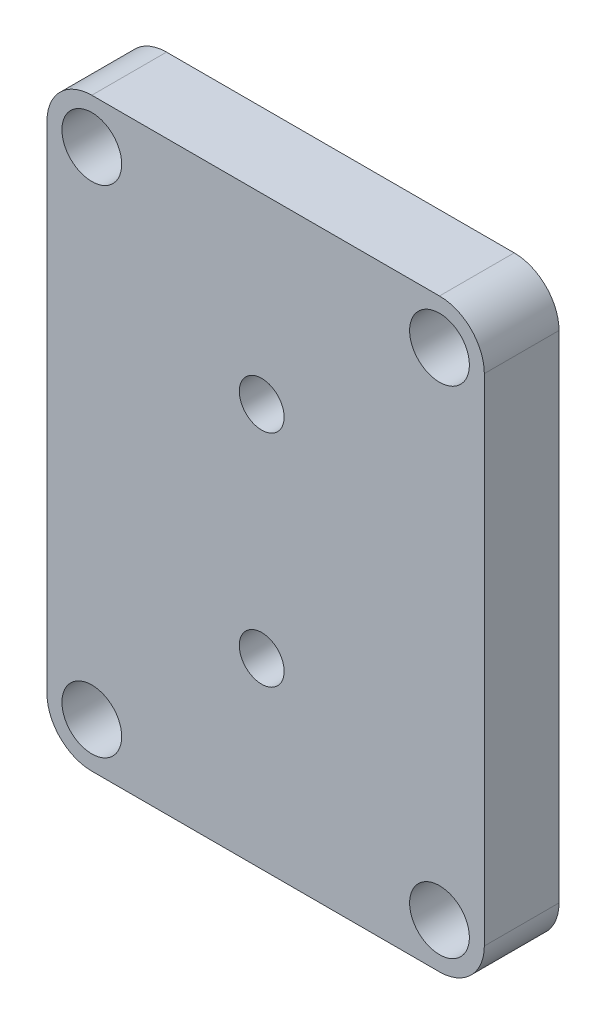
from build123d import *

# Parameters (mm, degrees)
ESQUISSE1_R        = 1.5
ESQUISSE1_R_2      = 2
BOSS_EXTRU_1_DEPTH = 5


with BuildPart() as part:
    # Esquisse1 → Boss.-Extru.1 (new body)
    with BuildSketch(Plane.XY):
        with BuildLine():
            Line((3, -2.444648676), (26.271947053, -2.444648676))
            ThreePointArc((26.271947053, -2.444648676), (28.393267396, -3.323328333), (29.271947053, -5.444648676))
            Line((29.271947053, -5.444648676), (29.271947053, -38.624023962))
            ThreePointArc((29.271947053, -38.624023962), (28.393267396, -40.745344306), (26.271947053, -41.624023962))
            Line((26.271947053, -41.624023962), (3, -41.624023962))
            ThreePointArc((3, -41.624023962), (0.878679656, -40.745344306), (0, -38.624023962))
            Line((0, -38.624023962), (0, -5.444648676))
            ThreePointArc((0, -5.444648676), (0.878679656, -3.323328333), (3, -2.444648676))
        make_face()
        with Locations((14.372577417, -14.669336319)):
            Circle(ESQUISSE1_R, mode=Mode.SUBTRACT)
        with Locations((14.372577417, -29.399336319)):
            Circle(ESQUISSE1_R, mode=Mode.SUBTRACT)
        with Locations((3, -5.444648676)):
            Circle(ESQUISSE1_R_2, mode=Mode.SUBTRACT)
        with Locations((26.271947053, -5.444648676)):
            Circle(ESQUISSE1_R_2, mode=Mode.SUBTRACT)
        with Locations((3, -38.624023962)):
            Circle(ESQUISSE1_R_2, mode=Mode.SUBTRACT)
        with Locations((26.271947053, -38.624023962)):
            Circle(ESQUISSE1_R_2, mode=Mode.SUBTRACT)
    extrude(amount=BOSS_EXTRU_1_DEPTH)


solid = part.part
